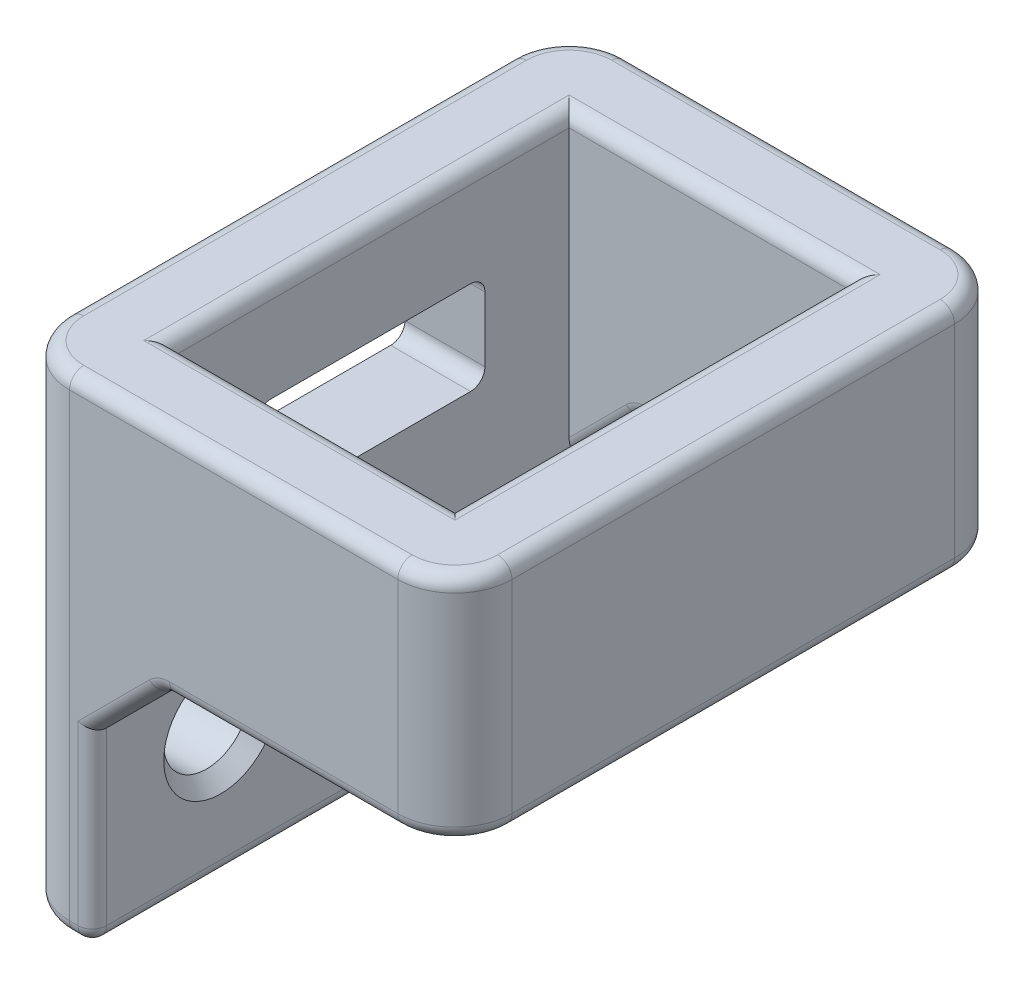
from build123d import *

# Parameters (mm, degrees)
SKETCH1_W                      = 15.5
SKETCH1_H                      = 19.5
SKETCH1_W_2                    = 9.9
SKETCH1_H_2                    = 13.9
BOSS_EXTRUDE1_DEPTH            = 4.05
SKETCH2_W                      = 19.5
SKETCH2_H                      = 9
SKETCH2_R                      = 1.5
BOSS_EXTRUDE2_DEPTH            = 2.8
CHAMFER1_SIZE                  = 2.5
FILLET1_R                      = 2
FILLET2_R                      = 0.5
CHAMFER2_SIZE                  = 0.5
CUT_EXTRUDE1_DEPTH             = 23.485884461
CUT_EXTRUDE1_DIRECTION_2_REACH = 24.486


with BuildPart() as part:
    # Sketch1 → Boss-Extrude1 (new, symmetric)
    with BuildSketch(Plane(origin=(0, 0, 0), x_dir=(1, 0, 0), z_dir=(0, 1, 0))):
        Rectangle(SKETCH1_W, SKETCH1_H)
        Rectangle(SKETCH1_W_2, SKETCH1_H_2, mode=Mode.SUBTRACT)
    extrude(amount=BOSS_EXTRUDE1_DEPTH, both=True)

    # Sketch2 → Boss-Extrude2 (add)
    with BuildSketch(Plane.ZY.offset(7.75)):
        with Locations((0, -8.55)):
            Rectangle(SKETCH2_W, SKETCH2_H)
        with Locations((-5.25, -8.55)):
            Circle(SKETCH2_R, mode=Mode.SUBTRACT)
        with Locations(Location((5.25, -8.55, 0), (0, 0, 180))):
            Circle(SKETCH2_R, mode=Mode.SUBTRACT)
    extrude(amount=-BOSS_EXTRUDE2_DEPTH)

    # Chamfer1
    chamfer1_edges = [part.edges().sort_by_distance(p)[0] for p in [
        (-4.95, -4.05, -8.35),
        (-4.95, -4.05, 8.35),
    ]]
    chamfer(chamfer1_edges, length=CHAMFER1_SIZE)

    # Fillet1
    fillet1_edges = [part.edges().sort_by_distance(p)[0] for p in [
        (-7.75, -4.5, -9.75),
        (7.75, 0, -9.75),
        (7.75, 0, 9.75),
        (-7.75, -4.5, 9.75),
    ]]
    fillet(fillet1_edges, radius=FILLET1_R)

    # Fillet2
    fillet2_edges = [part.edges().sort_by_distance(p)[0] for p in [
        (4.95, -4.05, 0),
        (1.25, -4.05, -6.95),
        (-4.95, 4.05, 0),
        (0, 4.05, 6.95),
        (4.95, 4.05, 0),
        (0, 4.05, -6.95),
        (-5.35, -13.05, -9.75),
        (-4.95, -9.8, 9.75),
        (-4.95, -13.05, 0),
        (-5.35, -13.05, 9.75),
        (1.65, -4.05, 9.75),
        (1.25, -4.05, 6.95),
        (-2.45, -4.05, 8.35),
        (-2.45, -4.05, -8.35),
        (-4.95, -9.8, -9.75),
        (-3.7, -5.3, -9.75),
        (-3.7, -5.3, -6.95),
        (-3.7, -5.3, 6.95),
        (-3.7, -5.3, 9.75),
        (1.65, -4.05, -9.75),
        (0, 4.05, -9.75),
        (7.75, -4.05, 0),
        (7.164213562, -4.05, 9.164213562),
        (7.164213562, -4.05, -9.164213562),
        (7.75, 4.05, 0),
        (-7.75, 4.05, 0),
        (0, 4.05, 9.75),
        (-7.164213562, 4.05, 9.164213562),
        (-7.164213562, 4.05, -9.164213562),
        (7.164213562, 4.05, 9.164213562),
        (7.164213562, 4.05, -9.164213562),
        (-7.75, -13.05, 0),
        (-7.164213562, -13.05, 9.164213562),
        (-7.164213562, -13.05, -9.164213562),
    ]]
    fillet(fillet2_edges, radius=FILLET2_R)

    # Chamfer2
    chamfer2_edges = [part.edges().sort_by_distance(p)[0] for p in [
        (-4.95, -8.55, 6.75),
        (-4.95, -8.55, -6.75),
    ]]
    chamfer(chamfer2_edges, length=CHAMFER2_SIZE)

    # Sketch3 → Cut-Extrude1 (cut)
    with BuildSketch(Plane.ZY.offset(7.75)):
        with BuildLine():
            Line((-3.5, 0.55), (3.5, 0.55))
            ThreePointArc((3.5, 0.55), (3.853553391, 0.403553391), (4, 0.05))
            Line((4, 0.05), (4, -2.22))
            ThreePointArc((4, -2.22), (3.853553391, -2.573553391), (3.5, -2.72))
            Line((3.5, -2.72), (-3.5, -2.72))
            ThreePointArc((-3.5, -2.72), (-3.853553391, -2.573553391), (-4, -2.22))
            Line((-4, -2.22), (-4, 0.05))
            ThreePointArc((-4, 0.05), (-3.853553391, 0.403553391), (-3.5, 0.55))
        make_face()
    extrude(amount=CUT_EXTRUDE1_DEPTH, mode=Mode.SUBTRACT)

    # Sketch3 → Cut-Extrude1 direction 2 (cut, up to next)
    with BuildSketch(Plane.ZY.offset(7.75), mode=Mode.PRIVATE) as cut_extrude1_direction_2_sk1:
        with BuildLine():
            Line((-3.5, 0.55), (3.5, 0.55))
            ThreePointArc((3.5, 0.55), (3.853553391, 0.403553391), (4, 0.05))
            Line((4, 0.05), (4, -2.22))
            ThreePointArc((4, -2.22), (3.853553391, -2.573553391), (3.5, -2.72))
            Line((3.5, -2.72), (-3.5, -2.72))
            ThreePointArc((-3.5, -2.72), (-3.853553391, -2.573553391), (-4, -2.22))
            Line((-4, -2.22), (-4, 0.05))
            ThreePointArc((-4, 0.05), (-3.853553391, 0.403553391), (-3.5, 0.55))
        make_face()
    cut_extrude1_direction_2_tool1 = extrude(cut_extrude1_direction_2_sk1.sketch, amount=-CUT_EXTRUDE1_DIRECTION_2_REACH, mode=Mode.PRIVATE) & part.part
    add(cut_extrude1_direction_2_tool1.solids().sort_by_distance((-7.75, -1.085, 0))[0], mode=Mode.SUBTRACT)


solid = part.part
